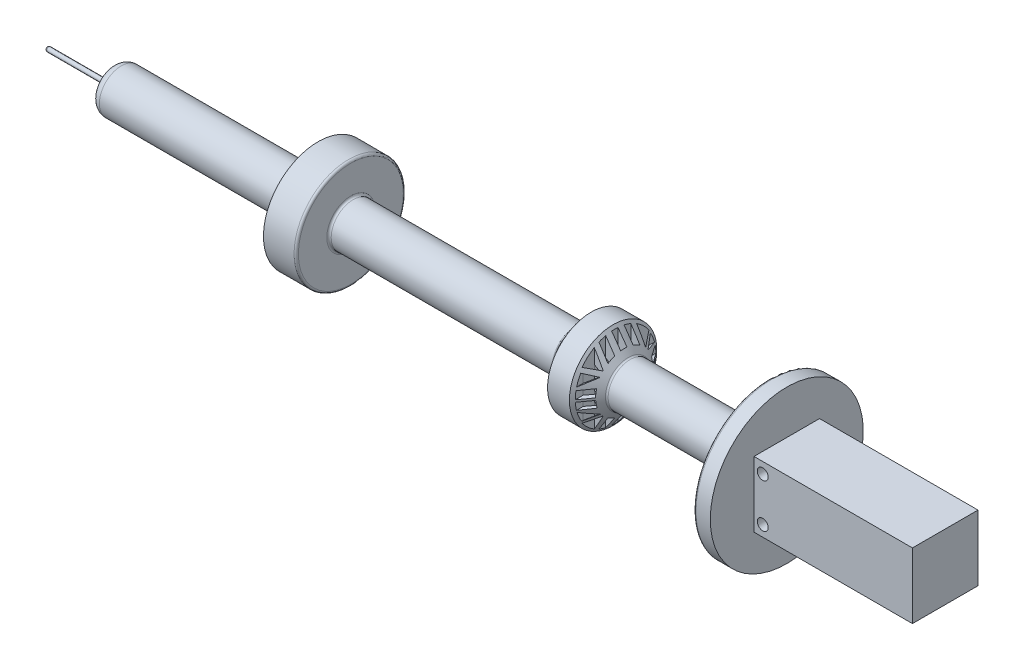
from build123d import *

# Parameters (mm, degrees)
SKETCH2_W           = 76.2
SKETCH2_H           = 76.2
BOSS_EXTRUDE2_DEPTH = 177.8
SKETCH5_W           = 76.2
SKETCH5_H           = 76.2
BOSS_EXTRUDE3_DEPTH = 6.35
FILLET1_R           = 10.16
FILLET2_R           = 2.54
FILLET3_R           = 2.54
FILLET4_R           = 2.54
FILLET5_R           = 2.54
FILLET6_R           = 2.54
FILLET7_R           = 2.54
FILLET8_R           = 2.54
FILLET9_R           = 2.54
SKETCH6_R           = 2.54
BOSS_EXTRUDE4_DEPTH = 76.2
FILLET10_R          = 2.54
SKETCH7_R           = 60.1788642
SKETCH7_R_2         = 57.997563704
CUT_EXTRUDE7_DEPTH  = 2.54
SKETCH10_W          = 10.49099021
SKETCH10_H          = 7.868242658
SKETCH10_H_2        = 7.868242657
SKETCH10_H_3        = 7.306225325
CUT_EXTRUDE11_DEPTH = 667.81201735
SKETCH11_W          = 9.920355278
SKETCH11_H          = 8.722967223
CUT_EXTRUDE12_DEPTH = 667.812017336
FILLET11_R          = 2.54
SKETCH12_R          = 6.35
CUT_EXTRUDE13_DEPTH = 664.728143813
SKETCH12_3_W        = 154.94
SKETCH12_3_H        = 40.64
SKETCH12_3_W_2      = 149.86
SKETCH12_3_H_2      = 35.56
CUT_EXTRUDE14_DEPTH = 5.08


with BuildPart() as part:
    # Sketch1 → Revolve1 (revolve)
    with BuildSketch(Plane(origin=(0, 0, 0), x_dir=(1, 0, 0), z_dir=(0, 1, 0))):
        Polygon((-569.170311421, 25.4), (-569.170311421, 0), (214.54292974, 0), (214.54292974, 88.9), (195.433810179, 88.9), (195.433810179, 61.802510767), (183.431422643, 61.802510767), (183.431422643, 25.4), (31.031422643, 25.4), (12.7, 50.8), (-12.7, 50.8), (-31.031422643, 25.4), (-292.1, 25.4), (-292.1, 63.5), (-330.2, 63.5), (-330.2, 25.4), align=None)
    revolve(axis=Axis((-569.170311421, 0, 0), (1, 0, 0)))

    # Sketch2 → Boss-Extrude2 (add)
    with BuildSketch(Plane(origin=(214.54292974, 0, 0), x_dir=(0, 0, -1), z_dir=(1, 0, 0))):
        Rectangle(SKETCH2_W, SKETCH2_H)
    extrude(amount=BOSS_EXTRUDE2_DEPTH)

    # Sketch5 → Boss-Extrude3 (add)
    with BuildSketch(Plane(origin=(392.34292974, 0, 0), x_dir=(0, 0, -1), z_dir=(1, 0, 0))):
        Rectangle(SKETCH5_W, SKETCH5_H)
    extrude(amount=BOSS_EXTRUDE3_DEPTH)

    # Fillet1
    fillet1_edges = [part.edges().sort_by_distance(p)[0] for p in [
        (-569.170311421, 0, 25.4),
    ]]
    fillet(fillet1_edges, radius=FILLET1_R)

    # Fillet2
    fillet2_edges = [part.edges().sort_by_distance(p)[0] for p in [
        (-292.1, 0, 25.4),
    ]]
    fillet(fillet2_edges, radius=FILLET2_R)

    # Fillet3
    fillet3_edges = [part.edges().sort_by_distance(p)[0] for p in [
        (-330.2, 0, 25.4),
    ]]
    fillet(fillet3_edges, radius=FILLET3_R)

    # Fillet4
    fillet4_edges = [part.edges().sort_by_distance(p)[0] for p in [
        (-31.031422643, 0, 25.4),
    ]]
    fillet(fillet4_edges, radius=FILLET4_R)

    # Fillet5
    fillet5_edges = [part.edges().sort_by_distance(p)[0] for p in [
        (31.031422643, 0, 25.4),
    ]]
    fillet(fillet5_edges, radius=FILLET5_R)

    # Fillet6
    fillet6_edges = [part.edges().sort_by_distance(p)[0] for p in [
        (183.431422643, 0, 25.4),
    ]]
    fillet(fillet6_edges, radius=FILLET6_R)

    # Fillet7
    fillet7_edges = [part.edges().sort_by_distance(p)[0] for p in [
        (183.431422643, 0, 61.802510767),
    ]]
    fillet(fillet7_edges, radius=FILLET7_R)

    # Fillet8
    fillet8_edges = [part.edges().sort_by_distance(p)[0] for p in [
        (195.433810179, 0, 61.802510767),
    ]]
    fillet(fillet8_edges, radius=FILLET8_R)

    # Fillet9
    fillet9_edges = [part.edges().sort_by_distance(p)[0] for p in [
        (195.433810179, 0, 88.9),
    ]]
    fillet(fillet9_edges, radius=FILLET9_R)

    # Sketch6 → Boss-Extrude4 (add)
    with BuildSketch(Plane.ZY.offset(569.170311421)):
        Circle(SKETCH6_R)
    extrude(amount=BOSS_EXTRUDE4_DEPTH)

    # Fillet10
    fillet10_edges = [part.edges().sort_by_distance(p)[0] for p in [
        (-645.370311421, 0, -2.54),
    ]]
    fillet(fillet10_edges, radius=FILLET10_R)

    # Sketch7 → Cut-Extrude7 (cut)
    with BuildSketch(Plane.ZY.offset(330.2)):
        Circle(SKETCH7_R)
        Circle(SKETCH7_R_2, mode=Mode.SUBTRACT)
    extrude(amount=-CUT_EXTRUDE7_DEPTH, mode=Mode.SUBTRACT)

    # Sketch10 → Cut-Extrude11 (cut, through all)
    with BuildSketch(Plane(origin=(0, 53.34, 0), x_dir=(1, 0, 0), z_dir=(0, 1, 0))):
        Polygon((-25.49890872, 25.055378045), (-15.00791851, 39.293150473), (-15.00791851, 25.055378045), align=None)
        Polygon((-25.49890872, -24.21480812), (-15.00791851, -24.21480812), (-15.00791851, -38.452580548), align=None)
        with Locations((-20.253413615, 14.377048724)):
            Rectangle(SKETCH10_W, SKETCH10_H)
        with Locations((-20.253413615, -14.847852576)):
            Rectangle(SKETCH10_W, SKETCH10_H_2)
        with Locations((-20.253413615, -0.329071481)):
            Rectangle(SKETCH10_W, SKETCH10_H_3)
        Polygon((15.00791851, -38.452580548), (25.49890872, -24.21480812), (15.00791851, -24.21480812), align=None)
        with Locations((20.253413615, -14.847852576)):
            Rectangle(SKETCH10_W, SKETCH10_H_2)
        with Locations((20.253413615, -0.329071481)):
            Rectangle(SKETCH10_W, SKETCH10_H_3)
        with Locations((20.253413615, 14.377048724)):
            Rectangle(SKETCH10_W, SKETCH10_H)
        Polygon((15.00791851, 25.055378045), (25.49890872, 25.055378045), (15.00791851, 39.293150473), align=None)
    extrude(amount=-CUT_EXTRUDE11_DEPTH, mode=Mode.SUBTRACT)

    # Sketch11 → Cut-Extrude12 (cut, through all)
    with BuildSketch(Plane.XY.offset(53.34)):
        Polygon((-25.472437366, 17.959160068), (-15.552082088, 23.60350014), (-15.552082088, 12.063442132), align=None)
        with Locations((-20.512259727, 4.361483612)):
            Rectangle(SKETCH11_W, SKETCH11_H)
        with Locations((-20.512259727, -6.927300331)):
            Rectangle(SKETCH11_W, SKETCH11_H)
        Polygon((-25.472437366, -19.327692529), (-15.552082088, -25.223410465), (-15.552082088, -13.683352457), align=None)
        Polygon((25.472437366, -19.327692529), (15.552082088, -25.223410465), (15.552082088, -13.683352457), align=None)
        with Locations((20.512259727, -6.927300331)):
            Rectangle(SKETCH11_W, SKETCH11_H)
        with Locations((20.512259727, 4.361483612)):
            Rectangle(SKETCH11_W, SKETCH11_H)
        Polygon((15.552082088, 23.60350014), (15.552082088, 12.063442132), (25.472437366, 17.959160068), align=None)
    extrude(amount=-CUT_EXTRUDE12_DEPTH, mode=Mode.SUBTRACT)

    # Fillet11
    fillet11_edges = [part.edges().sort_by_distance(p)[0] for p in [
        (-292.1, 0, 63.5),
    ]]
    fillet(fillet11_edges, radius=FILLET11_R)

    # Sketch12 → Cut-Extrude13 (cut, through all)
    with BuildSketch(Plane(origin=(0, 0, -38.1), x_dir=(-1, 0, 0), z_dir=(0, 0, -1))):
        with Locations((-224.70292974, -25.4)):
            Circle(SKETCH12_R)
        with Locations((-224.70292974, 25.4)):
            Circle(SKETCH12_R)
    extrude(amount=-CUT_EXTRUDE13_DEPTH, mode=Mode.SUBTRACT)

    # Sketch12<3> → Cut-Extrude14 (cut)
    with BuildSketch(Plane(origin=(0, 0, -38.1), x_dir=(-1, 0, 0), z_dir=(0, 0, -1))):
        with Locations((-307.25292974, 0)):
            Rectangle(SKETCH12_3_W, SKETCH12_3_H)
        with Locations((-307.25292974, 0)):
            Rectangle(SKETCH12_3_W_2, SKETCH12_3_H_2, mode=Mode.SUBTRACT)
    extrude(amount=-CUT_EXTRUDE14_DEPTH, mode=Mode.SUBTRACT)


solid = part.part
